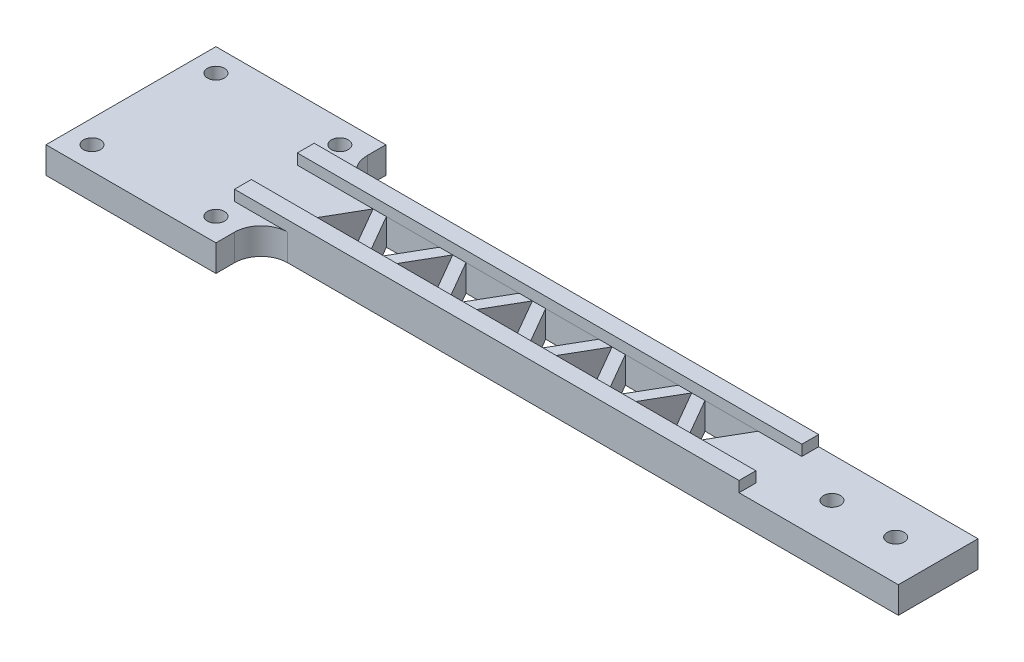
from build123d import *

# Parameters (mm, degrees)
SKETCH_1_W          = 120
SKETCH_1_H          = 15
EXTRUDE_1_DEPTH     = 5
SKETCH_2_R          = 1.6
CUT_EXTRUDE_1_DEPTH = 10
SKETCH_3_W          = 32
SKETCH_3_H          = 32
EXTRUDE_2_DEPTH     = 5
CUT_EXTRUDE_2_DEPTH = 7.5
FILLET_2_R          = 5
FILLET_4_R          = 5
CUT_EXTRUDE_3_DEPTH = 10
SKETCH_12_W         = 3.17
SKETCH_12_H         = 2
EXTRUDE_4_DEPTH     = 95


with BuildPart() as part:
    # Эскиз1 → Бобышка-Вытянуть1 (new body)
    with BuildSketch(Plane(origin=(0, 0, 0), x_dir=(1, 0, 0), z_dir=(0, 1, 0))):
        with Locations((-6.611570248, 6.549586777)):
            Rectangle(SKETCH_1_W, SKETCH_1_H)
    extrude(amount=EXTRUDE_1_DEPTH)

    # Эскиз2 → Вырез-Вытянуть1 (cut)
    with BuildSketch(Plane(origin=(0, 5, 0), x_dir=(1, 0, 0), z_dir=(0, 1, 0))):
        with Locations(Location((45.388429752, 6.549586777, 0), (0, 0, 270))):
            Circle(SKETCH_2_R)
        with Locations(Location((33.388429752, 6.549586777, 0), (0, 0, 270))):
            Circle(SKETCH_2_R)
    extrude(amount=-CUT_EXTRUDE_1_DEPTH, mode=Mode.SUBTRACT)

    # Эскиз3 → Бобышка-Вытянуть2 (add)
    with BuildSketch(Plane(origin=(0, 5, 0), x_dir=(1, 0, 0), z_dir=(0, 1, 0))):
        with Locations((-82.611570248, 6.549586777)):
            Rectangle(SKETCH_3_W, SKETCH_3_H)
    extrude(amount=-EXTRUDE_2_DEPTH)

    # Эскиз4 → Вырез-Вытянуть2 (cut)
    with BuildSketch(Plane(origin=(0, 5, 0), x_dir=(1, 0, 0), z_dir=(0, 1, 0))):
        with BuildLine():
            ThreePointArc((-95.412029446, 19.350045975), (-95.412029446, 17.087304275), (-93.149287746, 17.087304275))
            Line((-93.149287746, 17.087304275), (-95.412029446, 19.350045975))
        make_face()
        with BuildLine():
            Line((-95.412029446, 19.350045975), (-93.149287746, 17.087304275))
            ThreePointArc((-93.149287746, 17.087304275), (-92.802451344, 17.606381633), (-92.680658596, 18.218675125))
            ThreePointArc((-92.680658596, 18.218675125), (-93.668365104, 19.696882377), (-95.412029446, 19.350045975))
        make_face()
        with BuildLine():
            ThreePointArc((-69.812937508, 19.348219516), (-72.075679208, 19.348219516), (-72.075679208, 17.085477817))
            Line((-72.075679208, 17.085477817), (-69.812937508, 19.348219516))
        make_face()
        with BuildLine():
            Line((-69.812937508, 19.348219516), (-72.075679208, 17.085477817))
            ThreePointArc((-72.075679208, 17.085477817), (-70.332014867, 16.738641414), (-69.344308358, 18.216848666))
            ThreePointArc((-69.344308358, 18.216848666), (-69.466101106, 18.829142158), (-69.812937508, 19.348219516))
        make_face()
        with BuildLine():
            ThreePointArc((-93.147461288, -3.986304263), (-95.410202987, -3.986304263), (-95.410202987, -6.249045963))
            Line((-95.410202987, -6.249045963), (-93.147461288, -3.986304263))
        make_face()
        with BuildLine():
            Line((-93.147461288, -3.986304263), (-95.410202987, -6.249045963))
            ThreePointArc((-95.410202987, -6.249045963), (-93.666538646, -6.595882365), (-92.678832138, -5.117675113))
            ThreePointArc((-92.678832138, -5.117675113), (-92.800624885, -4.505381621), (-93.147461288, -3.986304263))
        make_face()
        with BuildLine():
            ThreePointArc((-69.346134817, -5.115848654), (-70.333841325, -3.637641402), (-72.077505667, -3.984477805))
            Line((-72.077505667, -3.984477805), (-69.814763967, -6.247219504))
            ThreePointArc((-69.814763967, -6.247219504), (-69.467927565, -5.728142146), (-69.346134817, -5.115848654))
        make_face()
        with BuildLine():
            Line((-69.814763967, -6.247219504), (-72.077505667, -3.984477805))
            ThreePointArc((-72.077505667, -3.984477805), (-72.077505667, -6.247219504), (-69.814763967, -6.247219504))
        make_face()
    extrude(amount=-CUT_EXTRUDE_2_DEPTH, mode=Mode.SUBTRACT)

    # Скругление2
    fillet_2_edges = [part.edges().sort_by_distance(p)[0] for p in [
        (-66.611570248, 2.5, 0.950413223),
    ]]
    fillet(fillet_2_edges, radius=FILLET_2_R)

    # Скругление4
    fillet_4_edges = [part.edges().sort_by_distance(p)[0] for p in [
        (-66.611570248, 2.5, -14.049586777),
    ]]
    fillet(fillet_4_edges, radius=FILLET_4_R)

    # Эскиз6 → Вырез-Вытянуть3 (cut)
    with BuildSketch(Plane(origin=(0, 5, 0), x_dir=(1, 0, 0), z_dir=(0, 1, 0))):
        Polygon((-62.351737512, 2.219586777), (-57.351737512, 10.879840815), (-52.351737512, 2.219586777), align=None)
        Polygon((-47.351737512, 2.219586777), (-42.351737512, 10.879840815), (-37.351737512, 2.219586777), align=None)
        Polygon((-32.351737512, 2.219586777), (-27.351737512, 10.879840815), (-22.351737512, 2.219586777), align=None)
        Polygon((-17.351737512, 2.219586777), (-12.351737512, 10.879840815), (-7.351737512, 2.219586777), align=None)
        Polygon((-2.351737512, 2.219586777), (2.648262488, 10.879840815), (7.648262488, 2.219586777), align=None)
        Polygon((-54.851737512, 10.879840815), (-49.851737512, 2.219586777), (-44.851737512, 10.879840815), align=None)
        Polygon((-39.851737512, 10.879840815), (-34.851737512, 2.219586777), (-29.851737512, 10.879840815), align=None)
        Polygon((-24.851737512, 10.879840815), (-19.851737512, 2.219586777), (-14.851737512, 10.879840815), align=None)
        Polygon((-9.851737512, 10.879840815), (-4.851737512, 2.219586777), (0.148262488, 10.879840815), align=None)
        Polygon((5.148262488, 10.879840815), (10.148262488, 2.219586777), (15.148262488, 10.879840815), align=None)
    extrude(amount=-CUT_EXTRUDE_3_DEPTH, mode=Mode.SUBTRACT)

    # Эскиз12 → Бобышка-Вытянуть4 (add)
    with BuildSketch(Plane(origin=(23.388429752, 0, 0), x_dir=(0, 0, -1), z_dir=(1, 0, 0))):
        with Locations((0.634586777, 6)):
            Rectangle(SKETCH_12_W, SKETCH_12_H)
        with Locations((12.464586777, 6)):
            Rectangle(SKETCH_12_W, SKETCH_12_H)
    extrude(amount=-EXTRUDE_4_DEPTH)


solid = part.part
